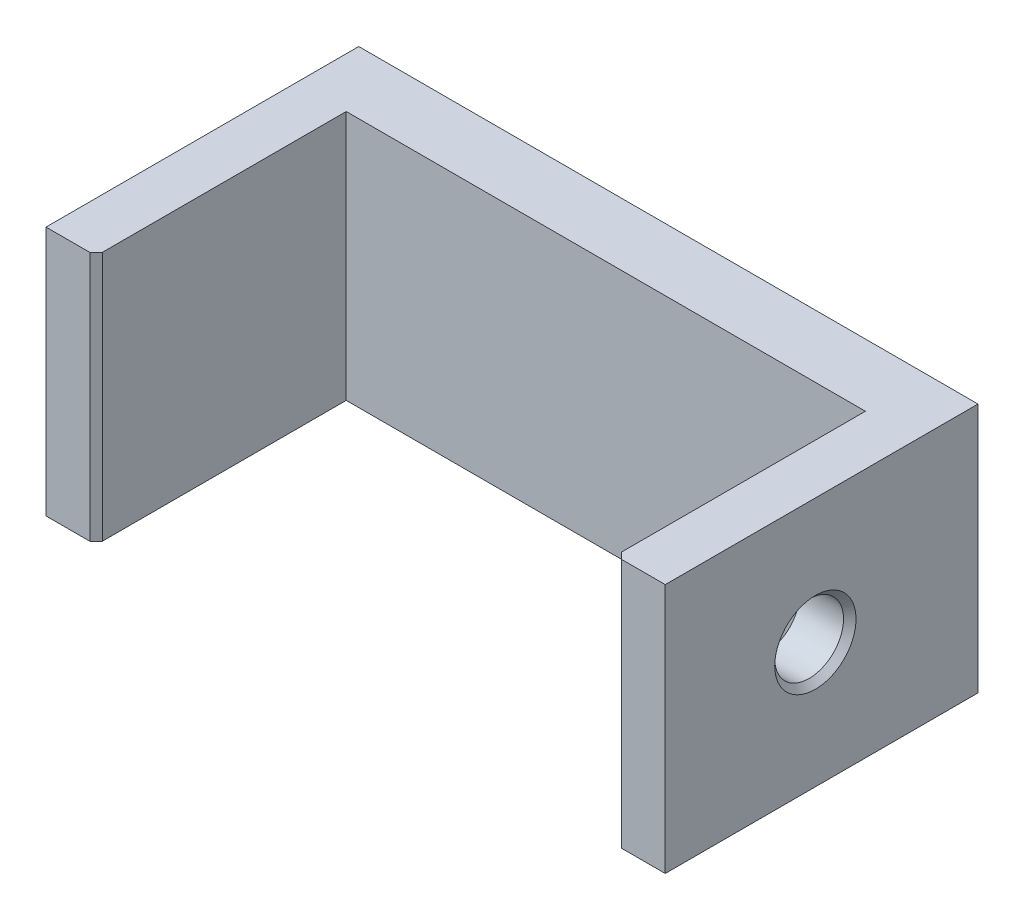
from build123d import *

# Parameters (mm, degrees)
SKETCH_1_W          = 49.5
SKETCH_1_H          = 20
EXTRUDE_1_DEPTH     = 5
SKETCH_3_W          = 4
SKETCH_3_H          = 20
EXTRUDE_2_DEPTH     = 20
CHAMFER_1_SIZE      = 0.5
SKETCH_4_R          = 2.75
CUT_EXTRUDE_1_DEPTH = 20
CHAMFER_2_SIZE      = 0.5


with BuildPart() as part:
    # 草图1 → 凸台-拉伸1 (new body)
    with BuildSketch(Plane.XY):
        with Locations((24.75, -10)):
            Rectangle(SKETCH_1_W, SKETCH_1_H)
    extrude(amount=EXTRUDE_1_DEPTH)

    # 草图3 → 凸台-拉伸2 (add)
    with BuildSketch(Plane.XY.offset(5)):
        with Locations((47.5, -10)):
            Rectangle(SKETCH_3_W, SKETCH_3_H)
        with Locations((2, -10)):
            Rectangle(SKETCH_3_W, SKETCH_3_H)
    extrude(amount=EXTRUDE_2_DEPTH)

    # 倒角1
    chamfer_1_edges = [part.edges().sort_by_distance(p)[0] for p in [
        (45.5, -10, 25),
        (4, -10, 25),
    ]]
    chamfer(chamfer_1_edges, length=CHAMFER_1_SIZE)

    # 草图4 → 切除-拉伸1 (cut)
    with BuildSketch(Plane(origin=(49.5, 0, 0), x_dir=(0, 0, -1), z_dir=(1, 0, 0))):
        with Locations((-13, -10)):
            Circle(SKETCH_4_R)
    extrude(amount=-CUT_EXTRUDE_1_DEPTH, mode=Mode.SUBTRACT)

    # 倒角2
    chamfer_2_edges = [part.edges().sort_by_distance(p)[0] for p in [
        (49.5, -10, 15.75),
    ]]
    chamfer(chamfer_2_edges, length=CHAMFER_2_SIZE)


solid = part.part
